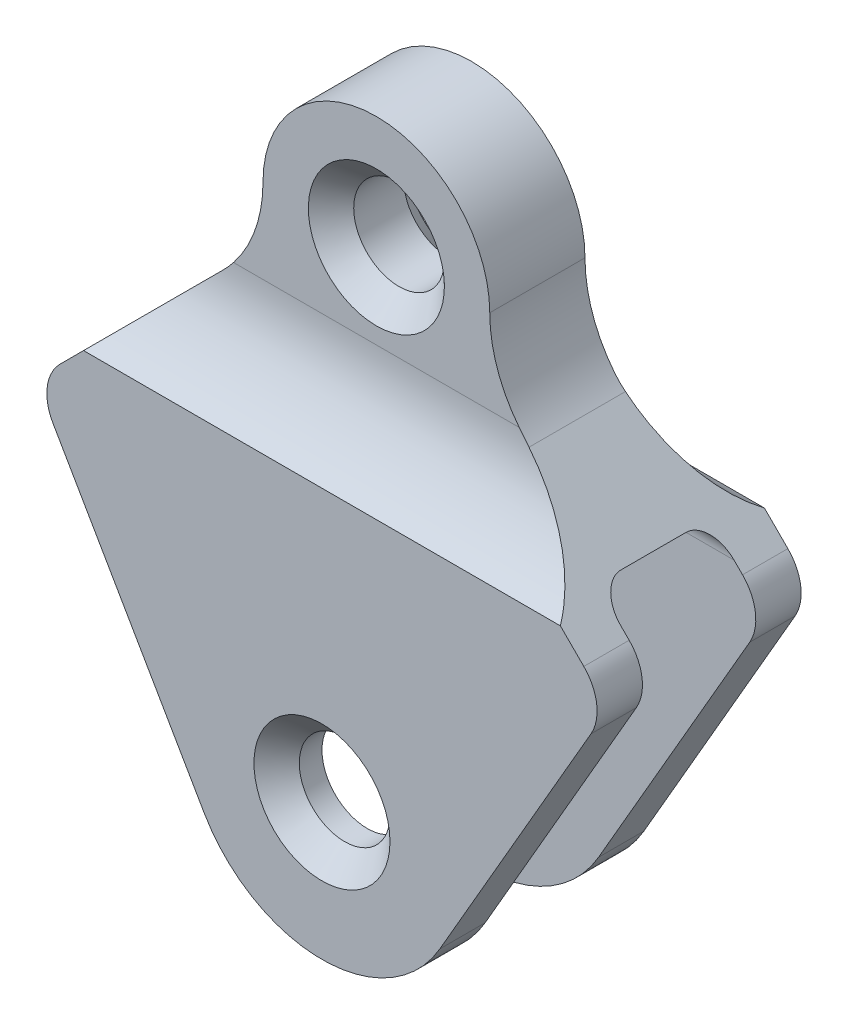
from build123d import *

# Parameters (mm, degrees)
SKETCH2_R               = 10
BOSS_EXTRUDE1_DEPTH     = 45
CUT_EXTRUDE2_DEPTH      = 147.050606819
CUT_EXTRUDE2_DEPTH_BACK = 147.050606819
CHAMFER1_SIZE           = 5


with BuildPart() as part:
    # Sketch2 → Boss-Extrude1 (new body)
    with BuildSketch(Plane.XY):
        with BuildLine():
            ThreePointArc((-25.980762114, -15), (0, -30), (25.980762114, -15))
            Line((25.980762114, -15), (59.329684168, 42.762027375))
            ThreePointArc((59.329684168, 42.762027375), (60.583878744, 49.067289298), (57.740497942, 54.833095187))
            Line((57.740497942, 54.833095187), (33.786796564, 78.786796564))
            ThreePointArc((33.786796564, 78.786796564), (27.283614025, 88.519497029), (25, 100))
            ThreePointArc((25, 100), (18.955379316, 116.300110275), (3.744512401, 124.717981853))
            ThreePointArc((3.744512401, 124.717981853), (0, 125), (-3.744512401, 124.717981853))
            ThreePointArc((-3.744512401, 124.717981853), (-18.955379316, 116.300110275), (-25, 100))
            ThreePointArc((-25, 100), (-27.283614025, 88.519497029), (-33.786796564, 78.786796564))
            Line((-33.786796564, 78.786796564), (-57.740497942, 54.833095187))
            ThreePointArc((-57.740497942, 54.833095187), (-60.583878744, 49.067289298), (-59.329684168, 42.762027375))
            Line((-59.329684168, 42.762027375), (-25.980762114, -15))
        make_face()
        with Locations(Location((0, 0, 0), (0, 0, 180))):
            Circle(SKETCH2_R, mode=Mode.SUBTRACT)
        with Locations(Location((0, 100, 0), (0, 0, 180))):
            Circle(SKETCH2_R, mode=Mode.SUBTRACT)
    extrude(amount=BOSS_EXTRUDE1_DEPTH)

    # Sketch3 → Cut-Extrude2 (cut, two sides: drawn at the far end of the back side and taken through both)
    with BuildSketch(Plane(origin=(0, 0, 0), x_dir=(0, 0, -1), z_dir=(1, 0, 0)).offset(-CUT_EXTRUDE2_DEPTH_BACK)):
        with BuildLine():
            Line((-12, 125), (-12, 81.354156504))
            ThreePointArc((-12, 81.354156504), (-8.794494718, 69.10670779), (0, 60))
            Line((0, 60), (0, 125))
            Line((0, 125), (-12, 125))
        make_face()
        with BuildLine():
            Line((-35, -30), (-22.5, -30))
            Line((-22.5, -30), (-22.5, 62))
            Line((-22.5, 62), (-29.704718934, 62))
            ThreePointArc((-29.704718934, 62), (-33.449048084, 60.449048084), (-35, 56.704718934))
            Line((-35, 56.704718934), (-35, -30))
        make_face()
        with BuildLine():
            Line((-22.5, -30), (-10, -30))
            Line((-10, -30), (-10, 56.704718934))
            ThreePointArc((-10, 56.704718934), (-11.550951916, 60.449048084), (-15.295281066, 62))
            Line((-15.295281066, 62), (-22.5, 62))
            Line((-22.5, 62), (-22.5, -30))
        make_face()
        with BuildLine():
            Line((-33, 125), (-33, 81.354156504))
            ThreePointArc((-33, 81.354156504), (-36.205505282, 69.10670779), (-45, 60))
            Line((-45, 60), (-45, 125))
            Line((-45, 125), (-33, 125))
        make_face()
    extrude(amount=CUT_EXTRUDE2_DEPTH + CUT_EXTRUDE2_DEPTH_BACK, mode=Mode.SUBTRACT)

    # Chamfer1
    chamfer1_edges = [part.edges().sort_by_distance(p)[0] for p in [
        (10, 100, 12),
        (10, 0, 0),
        (10, 0, 45),
        (10, 100, 33),
    ]]
    chamfer(chamfer1_edges, length=CHAMFER1_SIZE)


solid = part.part
